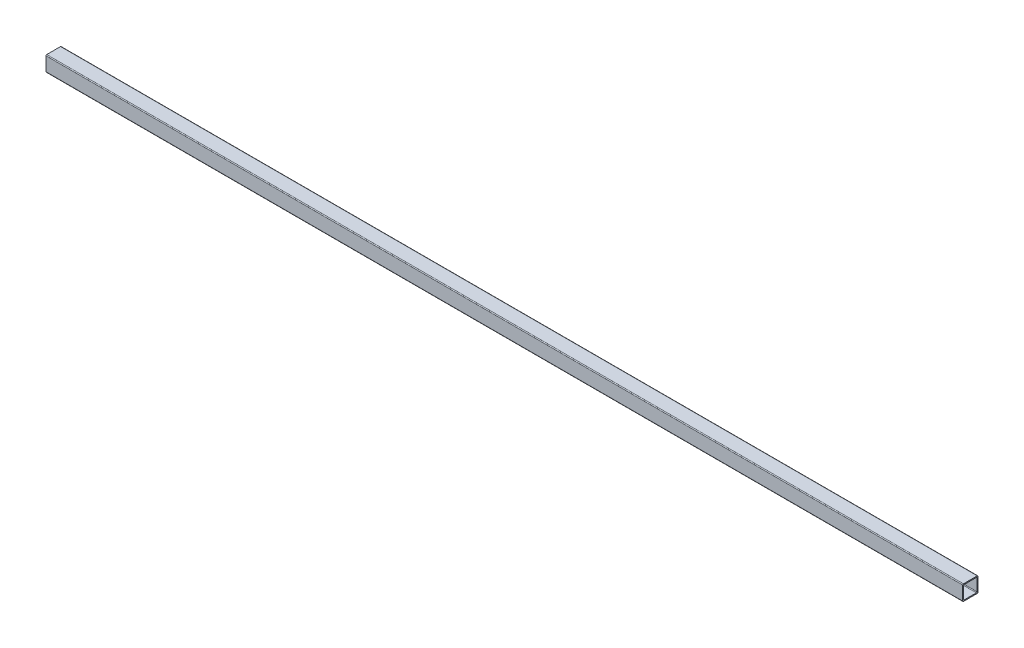
from build123d import *

# Parameters (mm, degrees)
BOSS_EXTRUDE1_DEPTH      = 762
BOSS_EXTRUDE1_DEPTH_BACK = 762


with BuildPart() as part:
    # Sketch4 → Boss-Extrude1 (new, two sides: drawn at the far end of the back side and taken through both)
    with BuildSketch(Plane(origin=(0, 0, 0), x_dir=(0, 0, -1), z_dir=(1, 0, 0)).offset(-BOSS_EXTRUDE1_DEPTH_BACK)):
        with BuildLine():
            Line((12.7, -11.43), (12.7, 11.43))
            ThreePointArc((12.7, 11.43), (12.328025612, 12.328025612), (11.43, 12.7))
            Line((11.43, 12.7), (-11.43, 12.7))
            ThreePointArc((-11.43, 12.7), (-12.328025612, 12.328025612), (-12.7, 11.43))
            Line((-12.7, 11.43), (-12.7, -11.43))
            ThreePointArc((-12.7, -11.43), (-12.328025612, -12.328025612), (-11.43, -12.7))
            Line((-11.43, -12.7), (11.43, -12.7))
            ThreePointArc((11.43, -12.7), (12.328025612, -12.328025612), (12.7, -11.43))
        make_face()
        with BuildLine():
            Line((11.049, 9.9441), (11.049, -9.9441))
            ThreePointArc((11.049, -9.9441), (10.725382283, -10.725382283), (9.9441, -11.049))
            Line((9.9441, -11.049), (-9.9441, -11.049))
            ThreePointArc((-9.9441, -11.049), (-10.725382283, -10.725382283), (-11.049, -9.9441))
            Line((-11.049, -9.9441), (-11.049, 9.9441))
            ThreePointArc((-11.049, 9.9441), (-10.725382283, 10.725382283), (-9.9441, 11.049))
            Line((-9.9441, 11.049), (9.9441, 11.049))
            ThreePointArc((9.9441, 11.049), (10.725382283, 10.725382283), (11.049, 9.9441))
        make_face(mode=Mode.SUBTRACT)
    extrude(amount=BOSS_EXTRUDE1_DEPTH + BOSS_EXTRUDE1_DEPTH_BACK)


solid = part.part
